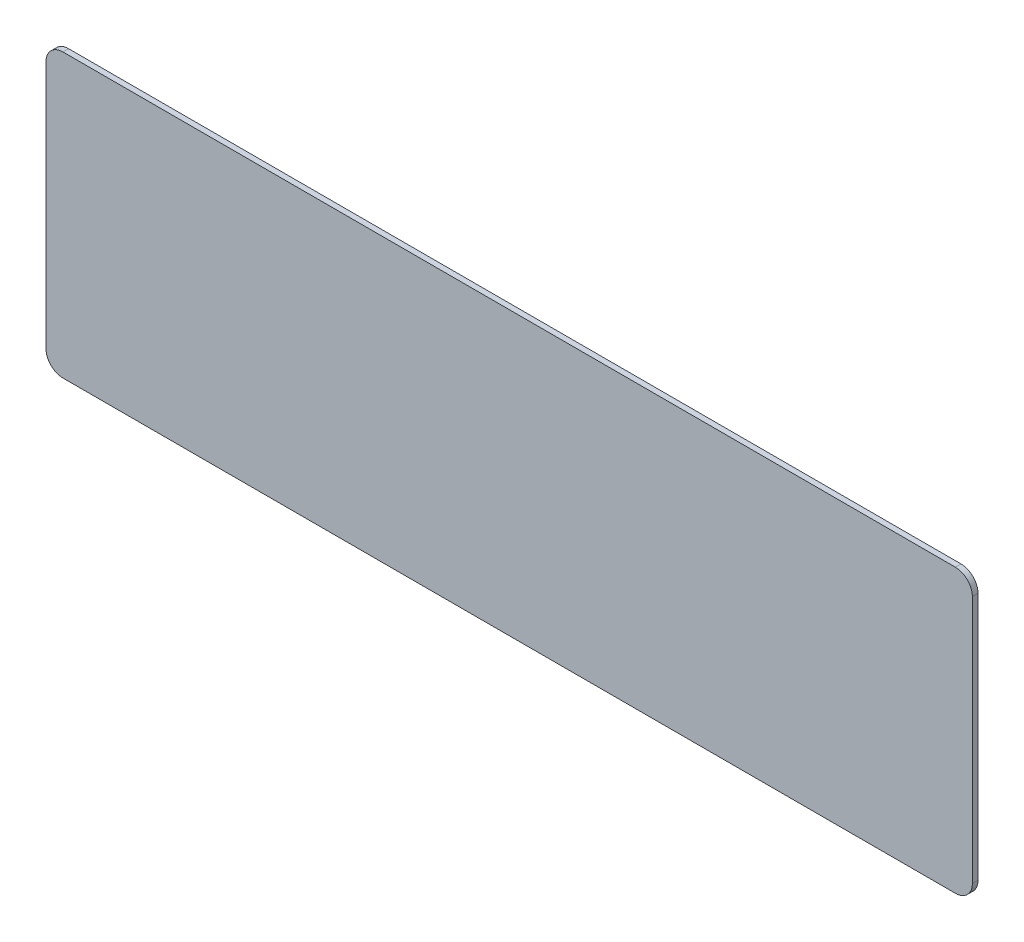
from build123d import *

# Parameters (mm, degrees)
SKETCH_1_W      = 164
SKETCH_1_H      = 50
EXTRUDE_1_DEPTH = 1
FILLET_1_R      = 3


with BuildPart() as part:
    # 草图1 → 凸台-拉伸1 (new body)
    with BuildSketch(Plane.XY):
        Rectangle(SKETCH_1_W, SKETCH_1_H)
    extrude(amount=EXTRUDE_1_DEPTH)

    # 圆角1
    fillet_1_edges = [part.edges().sort_by_distance(p)[0] for p in [
        (82, -25, 0.5),
        (-82, -25, 0.5),
        (-82, 25, 0.5),
        (82, 25, 0.5),
    ]]
    fillet(fillet_1_edges, radius=FILLET_1_R)


solid = part.part
